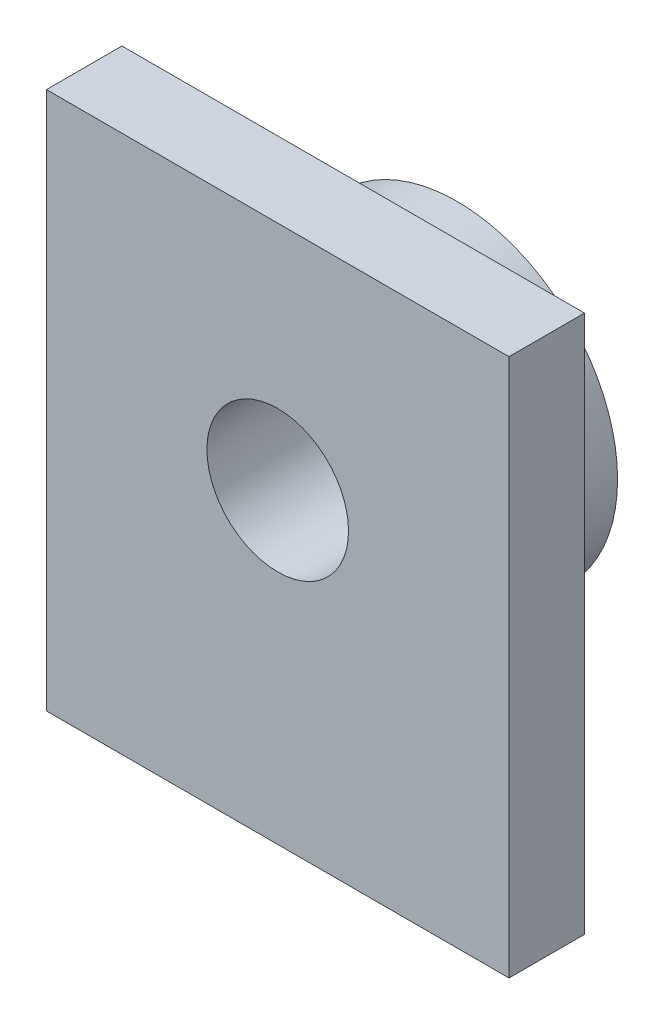
from build123d import *
from build123d.topology import SkipClean

# Parameters (mm, degrees)
SKETCH1_W           = 9.8
SKETCH1_H           = 11.4
SKETCH1_R           = 1.5
BOSS_EXTRUDE1_DEPTH = 1.6
BOSS_EXTRUDE2_START = 2.2
SKETCH2_R           = 3.4
SKETCH2_R_2         = 1.5
BOSS_EXTRUDE2_DEPTH = 2.2


with BuildPart() as part:
    # Sketch1 → Boss-Extrude1 (new body)
    with BuildSketch(Plane.XY):
        with Locations((0, -0.8)):
            Rectangle(SKETCH1_W, SKETCH1_H)
        Circle(SKETCH1_R, mode=Mode.SUBTRACT)
    extrude(amount=BOSS_EXTRUDE1_DEPTH)

    # Sketch2 → Boss-Extrude2 (add)
    with SkipClean():  # the faces are left unmerged after this step: merging them gives an invalid solid
        with BuildSketch(Plane(origin=(0, 0, 0), x_dir=(-1, 0, 0), z_dir=(0, 0, -1)).offset(BOSS_EXTRUDE2_START)):
            Circle(SKETCH2_R)
            Circle(SKETCH2_R_2, mode=Mode.SUBTRACT)
        extrude(amount=-BOSS_EXTRUDE2_DEPTH)


solid = part.part
